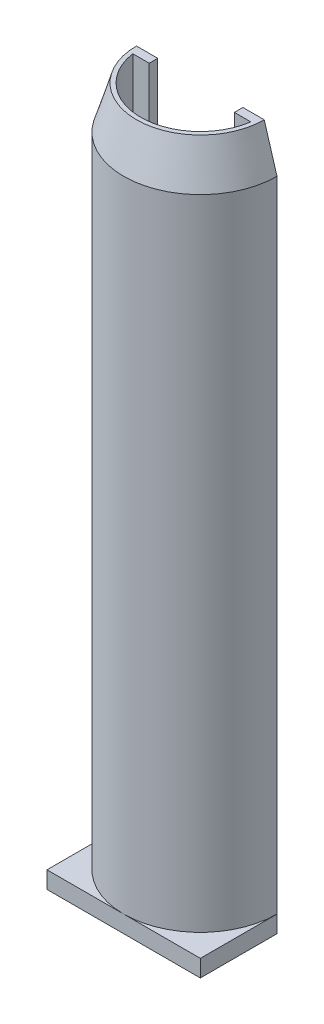
from build123d import *

# Parameters (mm, degrees)
REVOLVE_1_ANGLE                           = 180
EXTRUDE_START                             = -10
EXTRUDE_2_DEPTH                           = 10
MIRROR_START                              = -10
MIRROR_1_AT_THE_SECOND_PLANE_COPY_1_DEPTH = 10
EXTRUDE_3_DEPTH                           = 2


with BuildPart() as part:
    # 草图1 → 旋转1 (revolve)
    with BuildSketch(Plane.XY):
        Polygon((24.016399615, 38.642830462), (22.516399615, 43.642830462), (22.016399615, 43.642830462), (22.016399615, -36.357169538), (24.016399615, -36.357169538), align=None)
    revolve(axis=Axis((15.016399615, 43.642830462, 0), (0, -1, 0)), revolution_arc=REVOLVE_1_ANGLE)

    # 草图2 → 凸台-拉伸2 (add)
    with BuildSketch(Plane(origin=(0, 43.642830462, 0), x_dir=(1, 0, 0), z_dir=(0, 1, 0)).offset(EXTRUDE_START)):
        with BuildLine():
            ThreePointArc((21.944602846, -1), (21.998427351, -0.501287038), (22.016399615, 0))
            Line((22.016399615, 0), (20.016399615, 0))
            Line((20.016399615, 0), (20.016399615, -1))
            Line((20.016399615, -1), (21.944602846, -1))
        make_face()
    extrude_2 = extrude(amount=EXTRUDE_2_DEPTH)

    # 镜向1: 凸台-拉伸2 across plane
    add(extrude_2.mirror(Plane.ZX.offset(3.642830462)))

    # 镜向1 at the second plane: 凸台-拉伸2 across plane
    add(extrude_2.mirror(Plane(origin=(15.016399615, 0, 0), x_dir=(0, 0, 1), z_dir=(1, 0, 0))))

    # 镜向1 at the second plane copy 1 sket → 镜向1 at the second plane copy 1 (add)
    with BuildSketch(Plane(origin=(30.032799231, -36.357169538, 0), x_dir=(-1, 0, 0), z_dir=(0, -1, 0)).offset(MIRROR_START)):
        with BuildLine():
            ThreePointArc((21.944602846, -1), (21.998427351, -0.501287038), (22.016399615, 0))
            Line((22.016399615, 0), (20.016399615, 0))
            Line((20.016399615, 0), (20.016399615, -1))
            Line((20.016399615, -1), (21.944602846, -1))
        make_face()
    extrude(amount=MIRROR_1_AT_THE_SECOND_PLANE_COPY_1_DEPTH)


with BuildPart() as body_2:
    # 草图3 → 凸台-拉伸3 (new body)
    with BuildSketch(Plane.XZ.offset(36.357169538)):
        with BuildLine():
            Line((24.016399615, 9), (6.016399615, 9))
            Line((6.016399615, 9), (6.016399615, 0))
            Line((6.016399615, 0), (8.016399615, 0))
            ThreePointArc((8.016399615, 0), (15.016399615, 7), (22.016399615, 0))
            Line((22.016399615, 0), (24.016399615, 0))
            Line((24.016399615, 0), (24.016399615, 9))
        make_face()
    extrude(amount=EXTRUDE_3_DEPTH)


solid = Compound([part.part, body_2.part])
